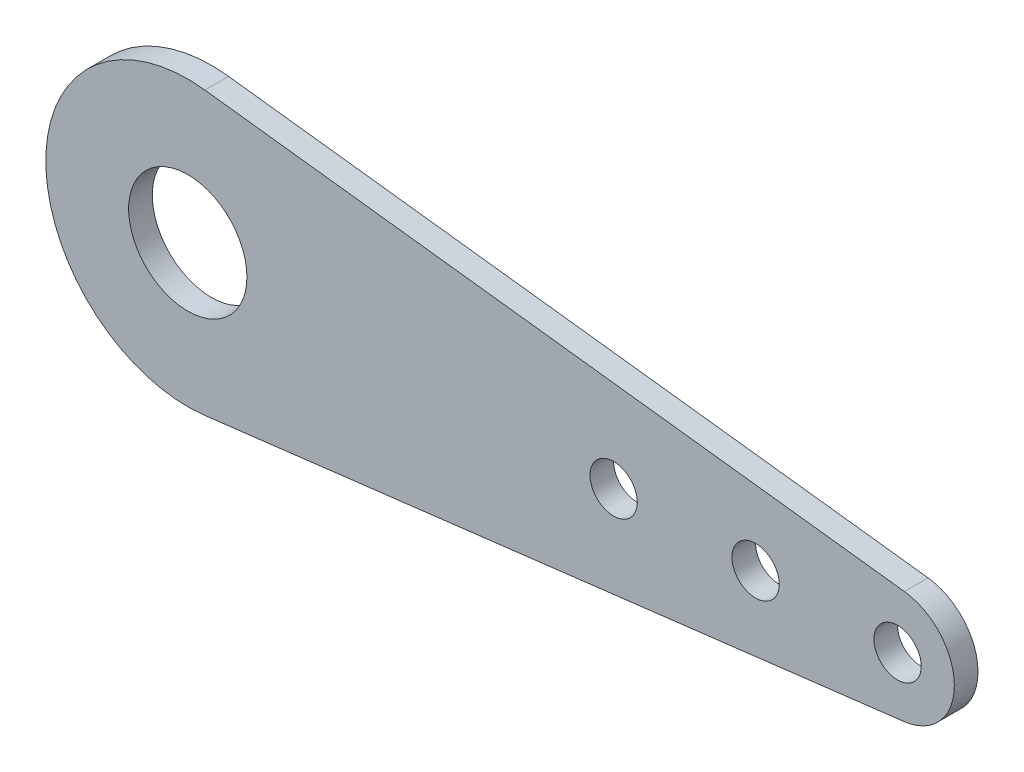
from build123d import *

# Parameters (mm, degrees)
EXTRUDE_FACE_DEPTH           = 1.5875
EXTRUDE_FACE_DEPTH_BACK      = 1.5875
FLAT_SKETCH_R                = 7.9375
EXTRUDE_CUT_HOLES_DEPTH      = 105.631064012
EXTRUDE_CUT_HOLES_DEPTH_BACK = 105.631064012
FLAT_SKETCH_4_R              = 3.175


with BuildPart() as part:
    # Flat sketch → Extrude face (new, two sides: drawn at the far end of the back side and taken through both)
    with BuildSketch(Plane.XY.offset(-EXTRUDE_FACE_DEPTH_BACK)):
        with BuildLine():
            Line((96.1644, 7.564937055), (2.286, 18.912342636))
            ThreePointArc((2.286, 18.912342636), (-19.05, 0), (2.286, -18.912342636))
            Line((2.286, -18.912342636), (96.1644, -7.564937055))
            ThreePointArc((96.1644, -7.564937055), (102.87, 0), (96.1644, 7.564937055))
        make_face()
        Circle(FLAT_SKETCH_R, mode=Mode.SUBTRACT)
    extrude(amount=EXTRUDE_FACE_DEPTH + EXTRUDE_FACE_DEPTH_BACK)

    # Flat sketch<4> → Extrude cut - holes (cut, two sides: drawn at the far end of the back side and taken through both)
    with BuildSketch(Plane.XY.offset(-EXTRUDE_CUT_HOLES_DEPTH_BACK)):
        with Locations((95.25, 0)):
            Circle(FLAT_SKETCH_4_R)
        with Locations((76.2, 0)):
            Circle(FLAT_SKETCH_4_R)
        with Locations((57.15, 0)):
            Circle(FLAT_SKETCH_4_R)
    extrude(amount=EXTRUDE_CUT_HOLES_DEPTH + EXTRUDE_CUT_HOLES_DEPTH_BACK, mode=Mode.SUBTRACT)


solid = part.part
